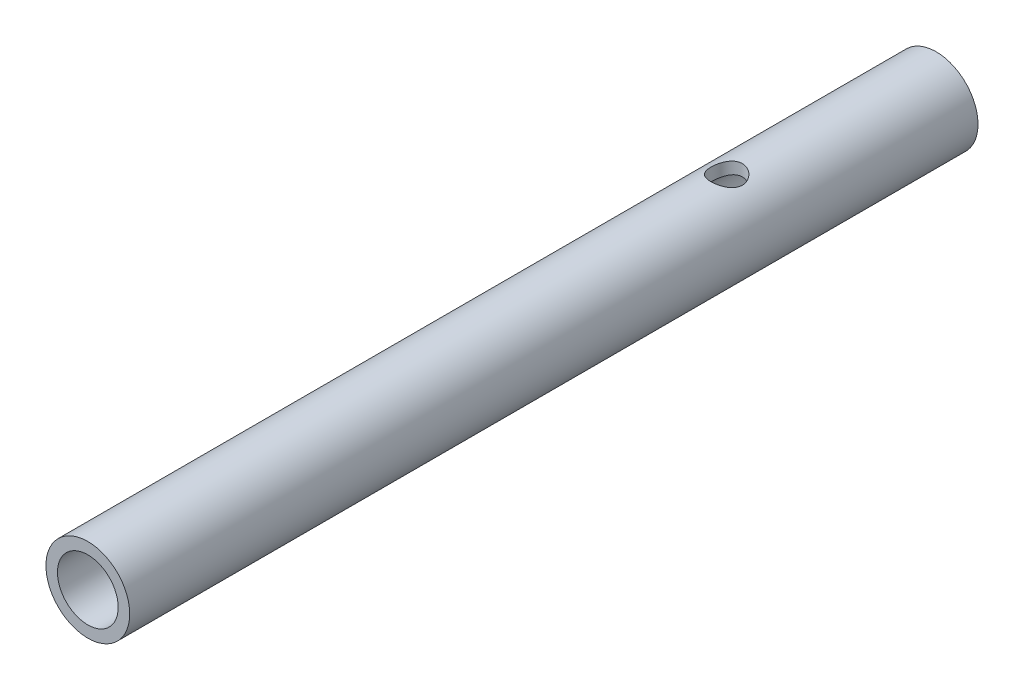
from build123d import *

# Parameters (mm, degrees)
SKETCH1_R                           = 4
SKETCH1_R_2                         = 2.9
SHAFT_BOSS_EXTRUDE1_DEPTH           = 81
CUT_EXTRUDE1_REACH                  = 83.197
CUT_EXTRUDE1_END_RADIUS             = 4
SKETCH2_R                           = 1.5
CUT_EXTRUDE1_DIRECTION_2_REACH      = 83.197
CUT_EXTRUDE1_DIRECTION_2_END_RADIUS = 4


with BuildPart() as part:
    # Sketch1 → Shaft Boss-Extrude1 (new body)
    with BuildSketch(Plane.XY):
        Circle(SKETCH1_R)
        Circle(SKETCH1_R_2, mode=Mode.SUBTRACT)
    extrude(amount=SHAFT_BOSS_EXTRUDE1_DEPTH)

    # Cut-Extrude1: up to this cylinder (the profile starts inside it)
    cut_extrude1_end = Plane(origin=(0, 0, 20), z_dir=(0, 0, -1)) * Cylinder(CUT_EXTRUDE1_END_RADIUS, 175.394, mode=Mode.PRIVATE)
    # Sketch2 → Cut-Extrude1 (cut, up to the surface)
    with BuildSketch(Plane(origin=(0, 0, 0), x_dir=(1, 0, 0), z_dir=(0, 1, 0)), mode=Mode.PRIVATE) as cut_extrude1_sk1:
        with Locations(Location((0, -20, 0), (0, 0, 270))):
            Circle(SKETCH2_R)
    cut_extrude1_tool1 = extrude(cut_extrude1_sk1.sketch, amount=-CUT_EXTRUDE1_REACH, mode=Mode.PRIVATE) & cut_extrude1_end
    add(cut_extrude1_tool1.solids().sort_by_distance((0, 0, 20))[0], mode=Mode.SUBTRACT)

    # Cut-Extrude1 direction 2: up to this cylinder (the profile starts inside it)
    cut_extrude1_direction_2_end = Plane(origin=(0, 0, 20), z_dir=(0, 0, -1)) * Cylinder(CUT_EXTRUDE1_DIRECTION_2_END_RADIUS, 175.394, mode=Mode.PRIVATE)
    # Sketch2 → Cut-Extrude1 direction 2 (cut, up to the surface)
    with BuildSketch(Plane(origin=(0, 0, 0), x_dir=(1, 0, 0), z_dir=(0, 1, 0)), mode=Mode.PRIVATE) as cut_extrude1_direction_2_sk1:
        with Locations(Location((0, -20, 0), (0, 0, 270))):
            Circle(SKETCH2_R)
    cut_extrude1_direction_2_tool1 = extrude(cut_extrude1_direction_2_sk1.sketch, amount=CUT_EXTRUDE1_DIRECTION_2_REACH, mode=Mode.PRIVATE) & cut_extrude1_direction_2_end
    add(cut_extrude1_direction_2_tool1.solids().sort_by_distance((0, 0, 20))[0], mode=Mode.SUBTRACT)


solid = part.part
